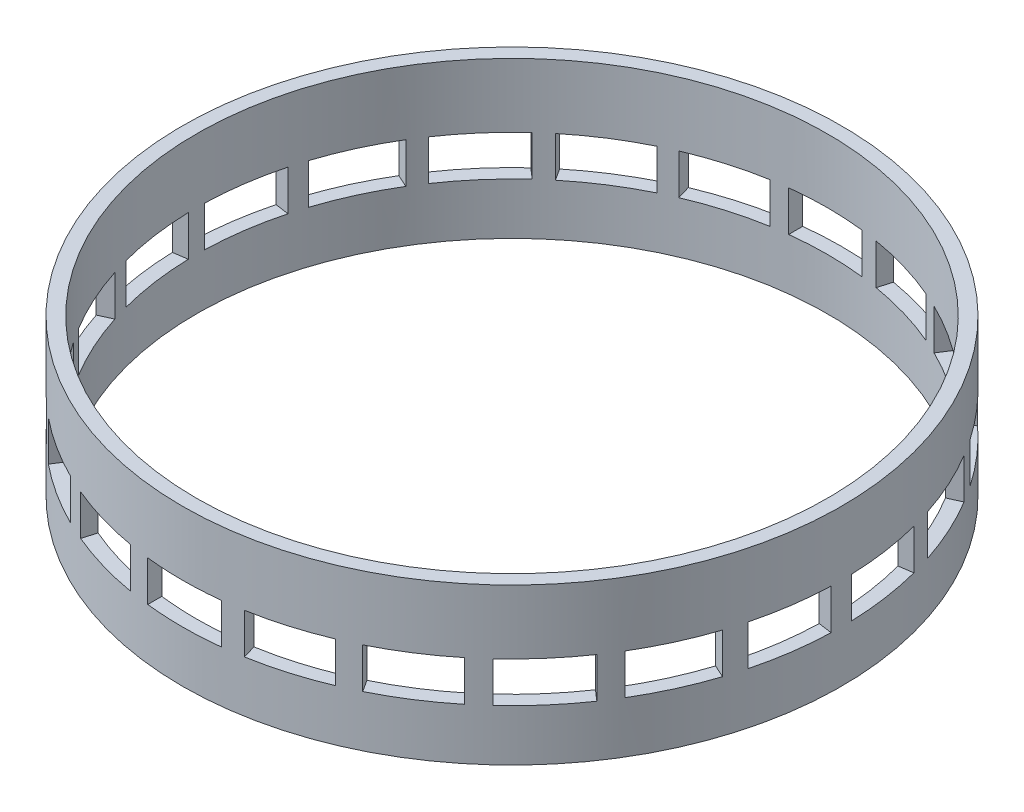
from build123d import *

# Parameters (mm, degrees)
SKETCH1_R           = 89.6625
SKETCH1_R_2         = 85.865
BOSS_EXTRUDE1_DEPTH = 42.425
SKETCH2_W           = 20
SKETCH2_H           = 11
CUT_EXTRUDE1_DEPTH  = 134.710913681
CIRPATTERN1_COUNT   = 11


with BuildPart() as part:
    # Sketch1 → Boss-Extrude1 (new body)
    with BuildSketch(Plane(origin=(0, 0, 0), x_dir=(1, 0, 0), z_dir=(0, 1, 0))):
        with Locations(Location((0, 0, 0), (0, 0, 90))):
            Circle(SKETCH1_R)
        with Locations(Location((0, 0, 0), (0, 0, 90))):
            Circle(SKETCH1_R_2, mode=Mode.SUBTRACT)
    extrude(amount=BOSS_EXTRUDE1_DEPTH)

    # Sketch2 → Cut-Extrude1 (cut, symmetric)
    with BuildSketch(Plane.XY):
        with Locations((0, 19.5)):
            Rectangle(SKETCH2_W, SKETCH2_H)
    cut_extrude1 = extrude(amount=CUT_EXTRUDE1_DEPTH, both=True, mode=Mode.SUBTRACT)

    # CirPattern1: Cut-Extrude1 ×11 about axis
    cirpattern1_axis = Axis((0, 0, 0), (0, 1, 0))
    for i in range(1, CIRPATTERN1_COUNT):
        add(cut_extrude1.rotate(cirpattern1_axis, i * 360 / CIRPATTERN1_COUNT), mode=Mode.SUBTRACT)


solid = part.part
